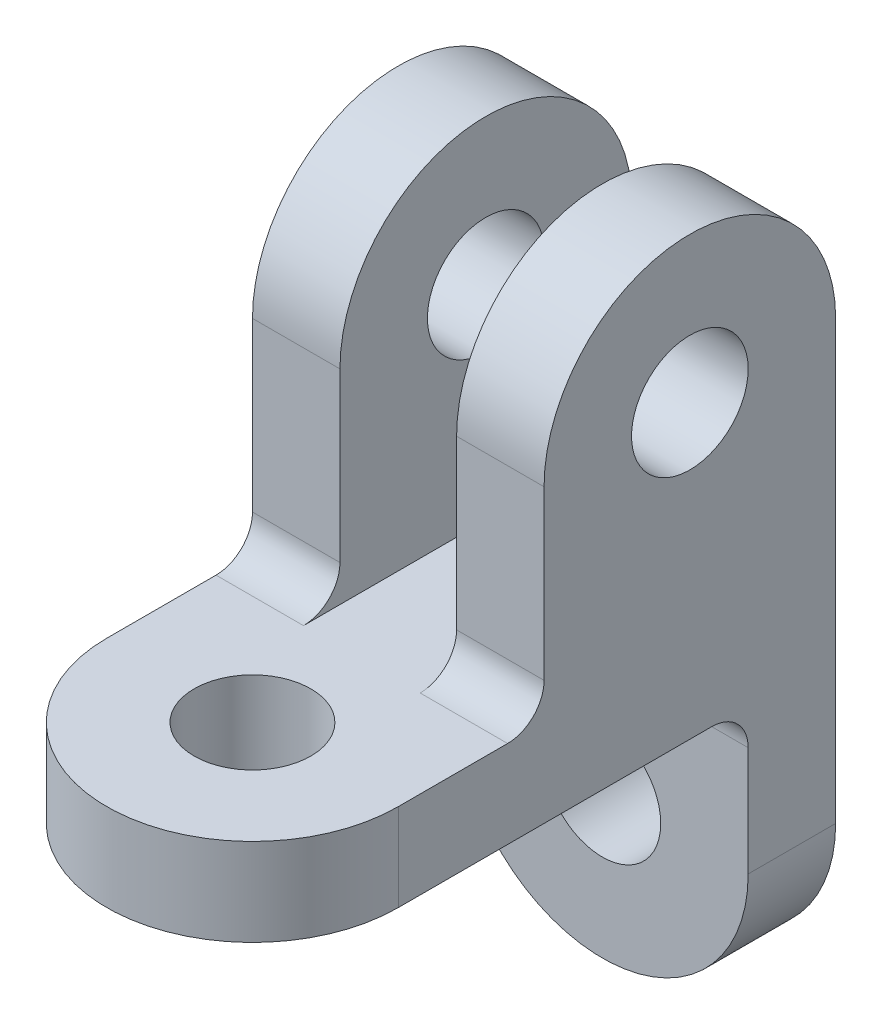
from build123d import *

# Parameters (mm, degrees)
SKETCH1_R           = 8
BOSS_EXTRUDE1_DEPTH = 12
SKETCH2_R           = 8
BOSS_EXTRUDE2_DEPTH = 12
SKETCH3_W           = 12
SKETCH3_H           = 48
BOSS_EXTRUDE3_DEPTH = 40
SKETCH4_R           = 8
CUT_EXTRUDE1_DEPTH  = 40
FILLET1_R           = 5


with BuildPart() as part:
    # Sketch1 → Boss-Extrude1 (new body)
    with BuildSketch(Plane.XY):
        with BuildLine():
            Line((0, 0), (0, 20))
            Line((0, 20), (40, 20))
            Line((40, 20), (40, 0))
            ThreePointArc((40, 0), (20, -20), (0, 0))
        make_face()
        with Locations((20, 0)):
            Circle(SKETCH1_R, mode=Mode.SUBTRACT)
    extrude(amount=BOSS_EXTRUDE1_DEPTH)

    # Sketch2 → Boss-Extrude2 (add)
    with BuildSketch(Plane(origin=(0, 20, 0), x_dir=(1, 0, 0), z_dir=(0, 1, 0))):
        with BuildLine():
            Line((0, 0), (40, 0))
            Line((40, 0), (40, -60))
            ThreePointArc((40, -60), (20, -80), (0, -60))
            Line((0, -60), (0, 0))
        make_face()
        with Locations(Location((20, -60, 0), (0, 0, 270))):
            Circle(SKETCH2_R, mode=Mode.SUBTRACT)
    extrude(amount=BOSS_EXTRUDE2_DEPTH)

    # Sketch3 → Boss-Extrude3 (add)
    with BuildSketch(Plane(origin=(0, 0, 0), x_dir=(-1, 0, 0), z_dir=(0, 0, -1))):
        with Locations((-34, 56)):
            Rectangle(SKETCH3_W, SKETCH3_H)
        with Locations((-6, 56)):
            Rectangle(SKETCH3_W, SKETCH3_H)
    extrude(amount=-BOSS_EXTRUDE3_DEPTH)

    # Sketch4 → Cut-Extrude1 (cut)
    with BuildSketch(Plane(origin=(40, 0, 0), x_dir=(0, 0, -1), z_dir=(1, 0, 0))):
        with BuildLine():
            ThreePointArc((-20, 80), (-5.857864376, 74.142135624), (0, 60))
            Line((0, 60), (0, 80))
            Line((0, 80), (-20, 80))
        make_face()
        with BuildLine():
            ThreePointArc((-40, 60), (-34.142135624, 74.142135624), (-20, 80))
            Line((-20, 80), (-40, 80))
            Line((-40, 80), (-40, 60))
        make_face()
        with Locations((-20, 60)):
            Circle(SKETCH4_R)
    extrude(amount=-CUT_EXTRUDE1_DEPTH, mode=Mode.SUBTRACT)

    # Fillet1
    fillet1_edges = [part.edges().sort_by_distance(p)[0] for p in [
        (20, 20, 12),
        (34, 32, 40),
        (6, 32, 40),
    ]]
    fillet(fillet1_edges, radius=FILLET1_R)


solid = part.part
